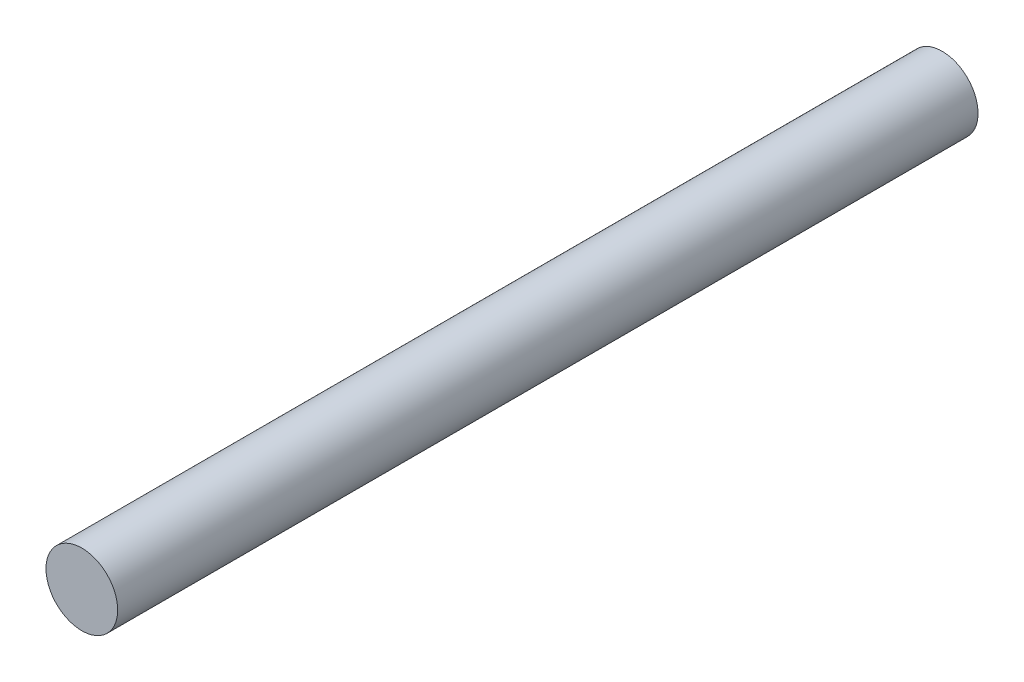
from build123d import *

# Parameters (mm, degrees)
SKETCH1_R           = 1.5875
BOSS_EXTRUDE1_DEPTH = 19.05


with BuildPart() as part:
    # Sketch1 → Boss-Extrude1 (new, symmetric)
    with BuildSketch(Plane.XY):
        with Locations(Location((0, 0, 0), (0, 0, 180))):
            Circle(SKETCH1_R)
    extrude(amount=BOSS_EXTRUDE1_DEPTH, both=True)


solid = part.part
